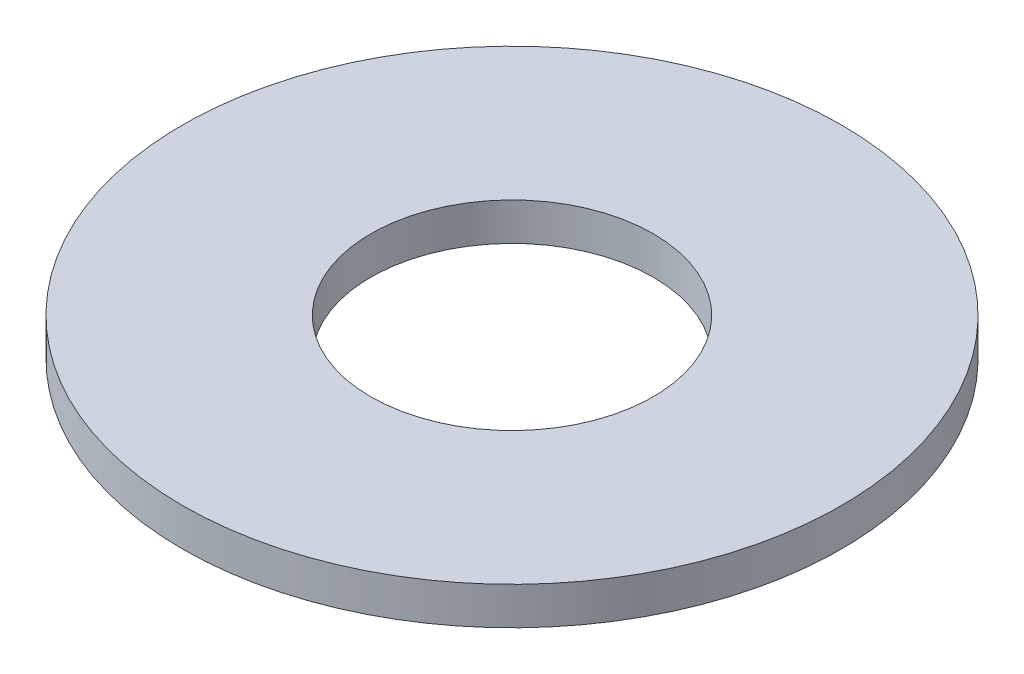
from build123d import *

# Parameters (mm, degrees)
SKETCH1_R           = 3.5
SKETCH1_R_2         = 1.5
BOSS_EXTRUDE1_DEPTH = 0.4


with BuildPart() as part:
    # Sketch1 → Boss-Extrude1 (new body)
    with BuildSketch(Plane(origin=(0, 0, 0), x_dir=(1, 0, 0), z_dir=(0, 1, 0))):
        with Locations(Location((0, 0, 0), (0, 0, 270))):
            Circle(SKETCH1_R)
        with Locations(Location((0, 0, 0), (0, 0, 270))):
            Circle(SKETCH1_R_2, mode=Mode.SUBTRACT)
    extrude(amount=BOSS_EXTRUDE1_DEPTH)


solid = part.part
